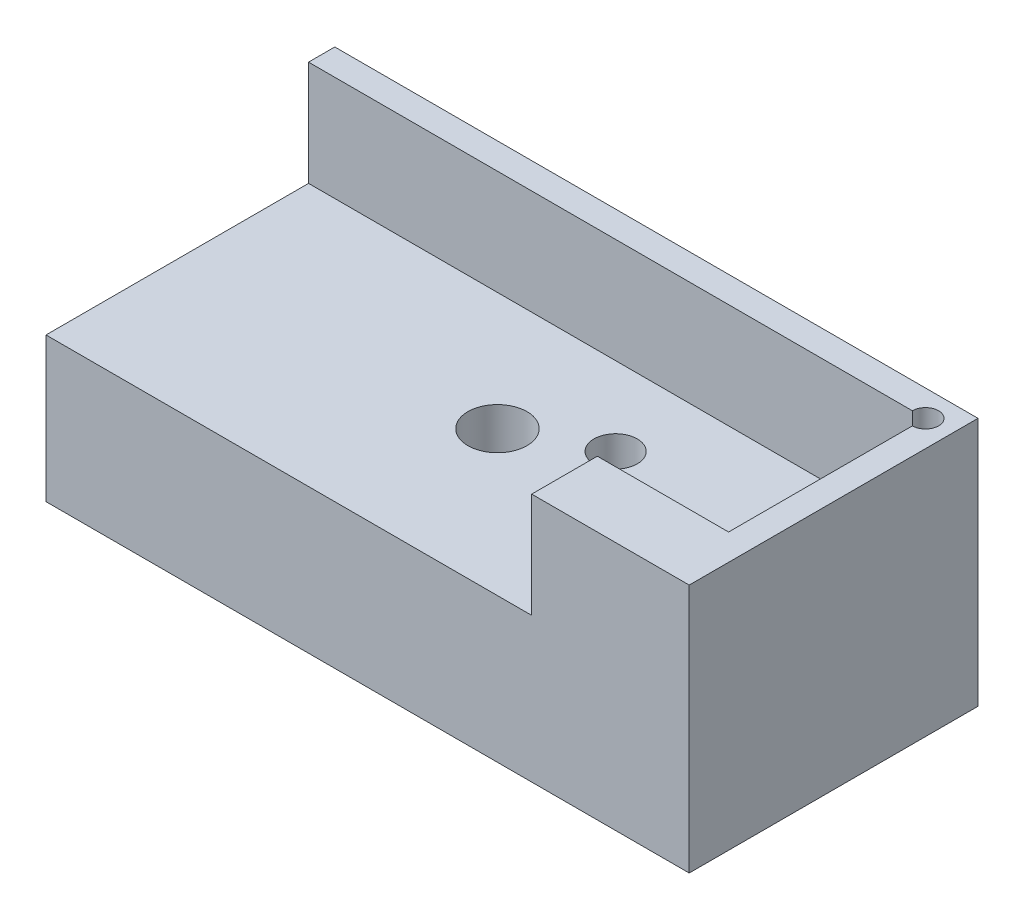
from build123d import *

# Parameters (mm, degrees)
SKETCH_1_W                = 47
SKETCH_1_H                = 18
EXTRUDE_1_DEPTH           = 6
EXTRUDE_2_DEPTH           = 8
EXTRUDE_2_DEPTH_BACK      = 6
SKETCH_15_W               = 49
SKETCH_15_H               = 22
EXTRUDE_3_DEPTH           = 5
SKETCH_12_W               = 2
SKETCH_12_H               = 8
CUT_EXTRUDE_5_DEPTH       = 37
SKETCH_19_W               = 10
SKETCH_19_H               = 8
EXTRUDE_4_DEPTH           = 3
SKETCH_13_R               = 1
CUT_EXTRUDE_6_DEPTH       = 8
CUT_EXTRUDE_START         = -2.844
SKETCH_5_W                = 25
SKETCH_5_H                = 25
CUT_EXTRUDE_1_DEPTH       = 2.844
HOLE_WIZARD_2_D           = 4.5
HOLE_WIZARD_2_CBORE_D     = 8
HOLE_WIZARD_2_CBORE_DEPTH = 4.6
HOLE_WIZARD_M4_4_D        = 3.3
SKETCH_17_W               = 20.485510756
SKETCH_17_H               = 2.844
CUT_EXTRUDE_8_DEPTH       = 0.5
SKETCH_18_R               = 1
CUT_EXTRUDE_9_DEPTH       = 2.844
FILLET_1_R                = 1


with BuildPart() as part:
    # 草图1 → 凸台-拉伸1 (new body)
    with BuildSketch(Plane(origin=(0, 0, 0), x_dir=(1, 0, 0), z_dir=(0, 1, 0))):
        Rectangle(SKETCH_1_W, SKETCH_1_H)
    extrude(amount=EXTRUDE_1_DEPTH)

    # 草图2 → 凸台-拉伸2 (add, two sides: drawn at the far end of the back side and taken through both)
    with BuildSketch(Plane(origin=(0, 6, 0), x_dir=(1, 0, 0), z_dir=(0, 1, 0)).offset(-EXTRUDE_2_DEPTH_BACK)):
        Polygon((23.5, 9), (-23.5, 9), (-23.5, 11), (25.5, 11), (25.5, -11), (-23.5, -11), (-23.5, -9), (23.5, -9), align=None)
    extrude(amount=EXTRUDE_2_DEPTH + EXTRUDE_2_DEPTH_BACK)

    # 草图15 → 凸台-拉伸3 (add)
    with BuildSketch(Plane(origin=(0, 0, 10), x_dir=(1, 0, 0), z_dir=(0, 1, 0))):
        with Locations((1, 10)):
            Rectangle(SKETCH_15_W, SKETCH_15_H)
    extrude(amount=-EXTRUDE_3_DEPTH)

    # 草图12 → 切除-拉伸5 (cut)
    with BuildSketch(Plane.ZY.offset(23.5)):
        with Locations((10, 10)):
            Rectangle(SKETCH_12_W, SKETCH_12_H)
    extrude(amount=-CUT_EXTRUDE_5_DEPTH, mode=Mode.SUBTRACT)

    # 草图19 → 凸台-拉伸4 (add)
    with BuildSketch(Plane(origin=(0, 0, 9), x_dir=(-1, 0, 0), z_dir=(0, 0, -1))):
        with Locations((-18.5, 10)):
            Rectangle(SKETCH_19_W, SKETCH_19_H)
    extrude(amount=EXTRUDE_4_DEPTH)

    # 草图13 → 切除-拉伸6 (cut)
    with BuildSketch(Plane(origin=(0, 14, 0), x_dir=(1, 0, 0), z_dir=(0, 1, 0))):
        with Locations((23.5, 9)):
            Circle(SKETCH_13_R)
    extrude(amount=-CUT_EXTRUDE_6_DEPTH, mode=Mode.SUBTRACT)

    # 草图5 → 切除-拉伸1 (cut)
    with BuildSketch(Plane.XZ.offset(5).offset(CUT_EXTRUDE_START)):
        with Locations((5.878, -3.014489244)):
            Rectangle(SKETCH_5_W, SKETCH_5_H)
    extrude(amount=CUT_EXTRUDE_1_DEPTH, mode=Mode.SUBTRACT)

    # 打孔尺寸(%根据)内六角圆柱头螺钉的类型2 (through all)
    with Locations(Plane(origin=(-0.122, -5, -0.014489244), x_dir=(0, 0, -1), z_dir=(0, -1, 0))):
        with Locations((0, 0)):
            CounterBoreHole(HOLE_WIZARD_2_D / 2, HOLE_WIZARD_2_CBORE_D / 2, HOLE_WIZARD_2_CBORE_DEPTH)

    # M4 螺纹孔4 (through all)
    with Locations(Plane(origin=(5.878, -2.156, -3.014489244), x_dir=(0, 0, -1), z_dir=(0, -1, 0))):
        with Locations((0, 0)):
            Hole(HOLE_WIZARD_M4_4_D / 2)

    # 草图17 → 切除-拉伸8 (cut)
    with BuildSketch(Plane.ZY.offset(-18.378)):
        with Locations((-0.757244622, -3.578)):
            Rectangle(SKETCH_17_W, SKETCH_17_H)
    extrude(amount=-CUT_EXTRUDE_8_DEPTH, mode=Mode.SUBTRACT)

    # 草图18 → 切除-拉伸9 (cut)
    with BuildSketch(Plane(origin=(0, -5, 0), x_dir=(-1, 0, 0), z_dir=(0, -1, 0))):
        with Locations((6.622, -9.485510756)):
            Circle(SKETCH_18_R)
    extrude(amount=-CUT_EXTRUDE_9_DEPTH, mode=Mode.SUBTRACT)

    # 圆角1
    fillet_1_edges = [part.edges().sort_by_distance(p)[0] for p in [
        (18.878, -3.578, 9.485510756),
    ]]
    fillet(fillet_1_edges, radius=FILLET_1_R)


solid = part.part
